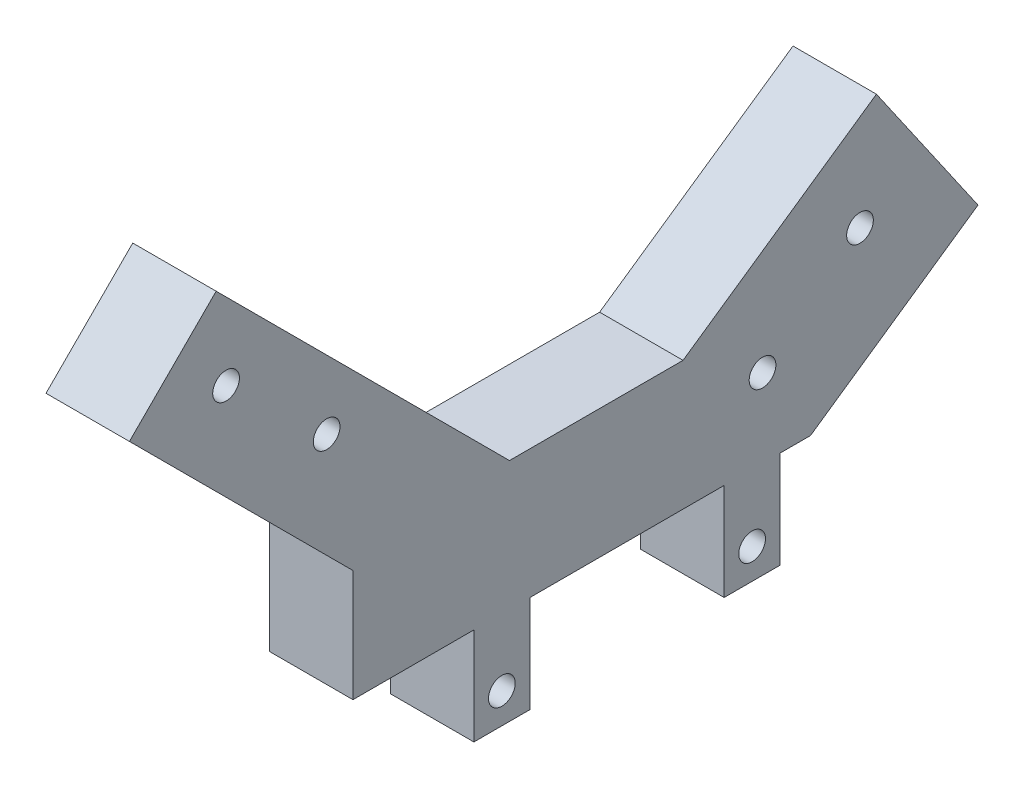
from build123d import *

# Parameters (mm, degrees)
SKETCH_1_R      = 1.6
EXTRUDE_1_DEPTH = 10


with BuildPart() as part:
    # 草图1 → 凸台-拉伸1 (new body)
    with BuildSketch(Plane(origin=(0, 0, 0), x_dir=(0, 0, -1), z_dir=(1, 0, 0))):
        Polygon((-11.648969443, -15.638868598), (-18.351030557, -15.638868598), (-18.351030557, -4), (-32.84837567, -4), (-32.84837567, 9.413253291), (-59.646723814, 36.211601436), (-49.248051864, 46.610273387), (-14.086489785, 11.448711308), (6.718740299, 11.448711308), (29.902965659, 27.489458326), (42.078824949, 9.89128379), (22.001290309, -4), (18.351030557, -4), (18.351030557, -15.638868598), (11.648969443, -15.638868598), (11.648969443, -4), (-11.648969443, -4), align=None)
        with Locations((-15, -12)):
            Circle(SKETCH_1_R, mode=Mode.SUBTRACT)
        with Locations(Location((15, -12, 0), (0, 0, 180))):
            Circle(SKETCH_1_R, mode=Mode.SUBTRACT)
        with Locations((-48.060514381, 36.211601436)):
            Circle(SKETCH_1_R, mode=Mode.SUBTRACT)
        with Locations((-36.002441477, 25.143249656)):
            Circle(SKETCH_1_R, mode=Mode.SUBTRACT)
        with Locations((16.249207774, 5.411857631)):
            Circle(SKETCH_1_R, mode=Mode.SUBTRACT)
        with Locations((27.931653437, 14.600109184)):
            Circle(SKETCH_1_R, mode=Mode.SUBTRACT)
    extrude(amount=EXTRUDE_1_DEPTH)


solid = part.part
